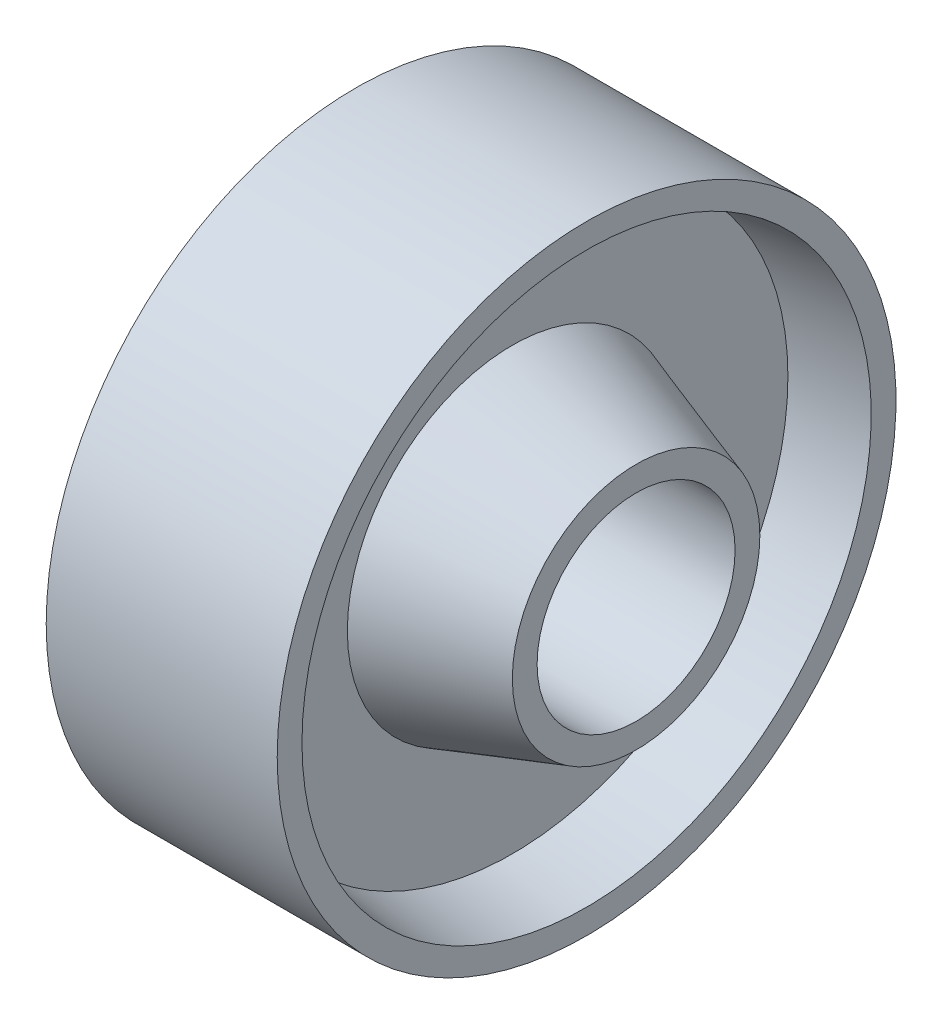
from build123d import *

# Parameters (mm, degrees)
SKETCH2_W = 10
SKETCH2_H = 13.40221624


with BuildPart() as part:
    # Sketch2 → Revolve1 (revolve)
    with BuildSketch(Plane.XY, mode=Mode.PRIVATE) as revolve1_sk:
        Polygon((14, 34.5), (5, 33.40221624), (-5, 33.40221624), (-14, 34.5), (-14, 37.5), (14, 37.5), align=None)
        with Locations((0, 26.70110812)):
            Rectangle(SKETCH2_W, SKETCH2_H)
        Polygon((20, 15), (20, 12), (-20, 12), (-20, 15), (-5, 20), (5, 20), align=None)
    revolve(revolve1_sk.sketch.rotate(Axis((-33.658224077, 0, 0), (1, 0, 0)), 90), axis=Axis((-33.658224077, 0, 0), (1, 0, 0)))


solid = part.part
